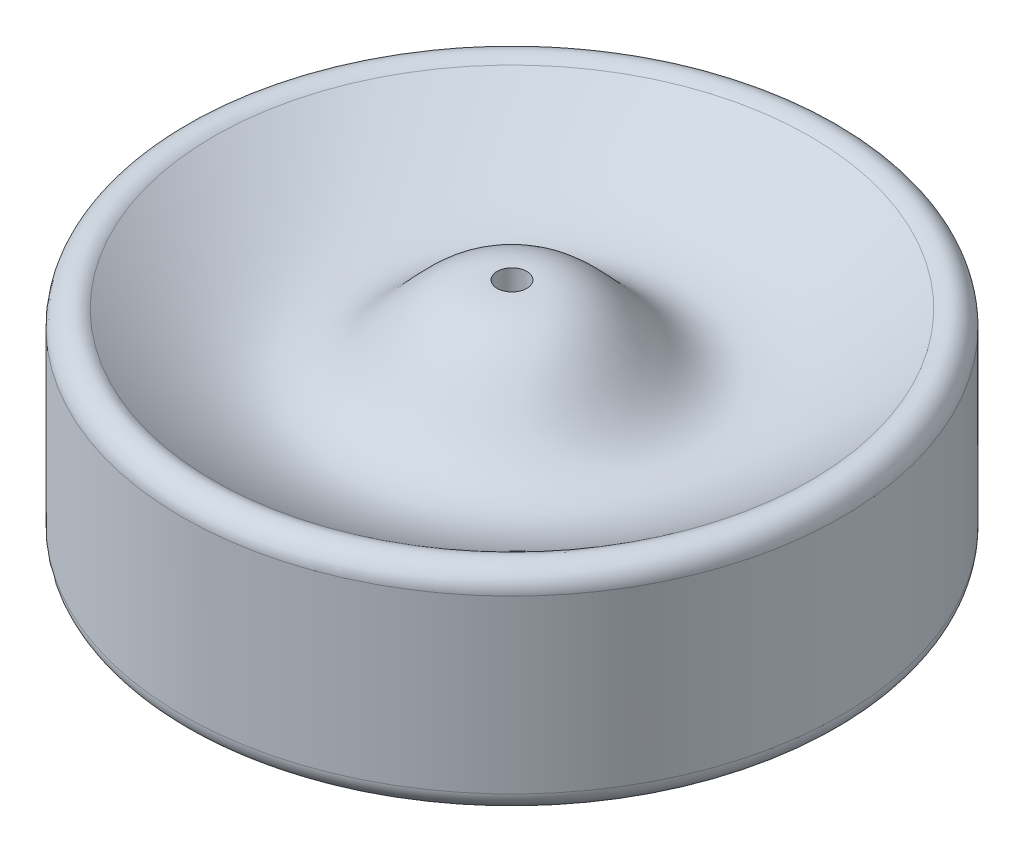
from build123d import *

# Parameters (mm, degrees)
FILLET1_R          = 3
SKETCH2_R          = 2.25
CUT_EXTRUDE1_DEPTH = 30


with BuildPart() as part:
    # Sketch1 → Revolve1 (revolve)
    with BuildSketch(Plane.XY, mode=Mode.PRIVATE) as revolve1_sk:
        with BuildLine():
            Line((0, 0), (50, 0))
            Line((50, 0), (50, 35))
            add(Edge.make_bspline(
                [(0, 35), (20.190635026, 38.073649128), (11.656369597, 5.024124106), (50, 35)],
                knots=[0, 0, 0, 0, 1, 1, 1, 1], degree=3))
            Line((0, 35), (0, 0))
        make_face()
    revolve(revolve1_sk.sketch.rotate(Axis((0, 0, 0), (0, 1, 0)), 90), axis=Axis((0, 0, 0), (0, 1, 0)))

    # Fillet1
    fillet1_edges = [part.edges().sort_by_distance(p)[0] for p in [
        (0, 35, 50),
        (0, 0, 50),
    ]]
    fillet(fillet1_edges, radius=FILLET1_R)

    # Sketch2 → Cut-Extrude1 (cut)
    with BuildSketch(Plane(origin=(0, 50, 0), x_dir=(1, 0, 0), z_dir=(0, 1, 0))):
        with Locations(Location((0, 0, 0), (0, 0, 270))):
            Circle(SKETCH2_R)
    extrude(amount=-CUT_EXTRUDE1_DEPTH, mode=Mode.SUBTRACT)


solid = part.part
